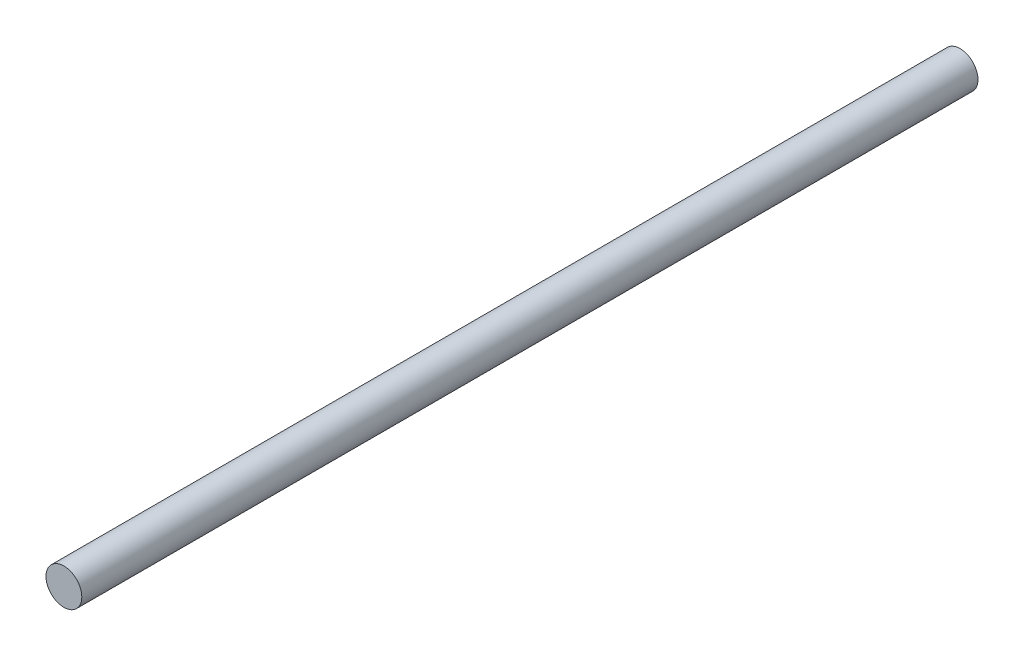
from build123d import *

# Parameters (mm, degrees)
SKETCH_1_R      = 0.5
EXTRUDE_1_DEPTH = 25


with BuildPart() as part:
    # 草图1 → 凸台-拉伸1 (new body)
    with BuildSketch(Plane.XY):
        Circle(SKETCH_1_R)
    extrude(amount=EXTRUDE_1_DEPTH)


solid = part.part
